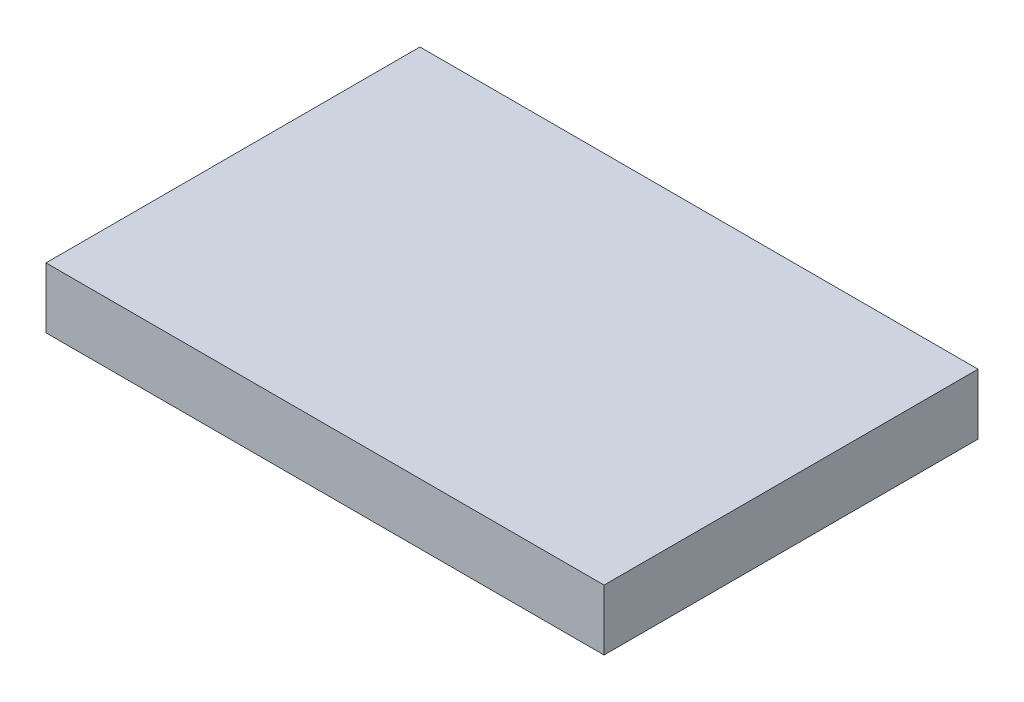
from build123d import *

# Parameters (mm, degrees)
SKETCH1_W           = 82.9
SKETCH1_H           = 55.55
BOSS_EXTRUDE1_DEPTH = 9


with BuildPart() as part:
    # Sketch1 → Boss-Extrude1 (new body)
    with BuildSketch(Plane(origin=(0, 0, 0), x_dir=(1, 0, 0), z_dir=(0, 1, 0))):
        Rectangle(SKETCH1_W, SKETCH1_H)
    extrude(amount=BOSS_EXTRUDE1_DEPTH)


solid = part.part
